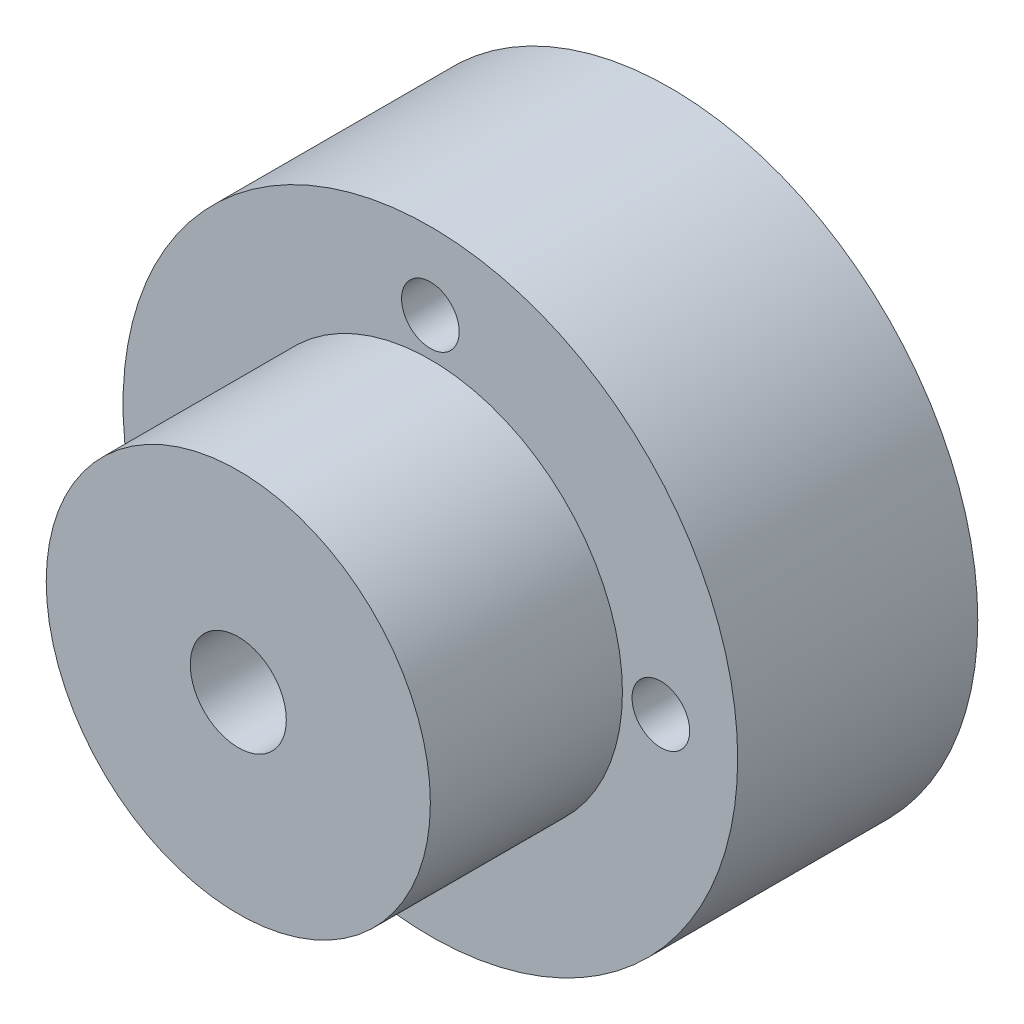
from build123d import *

# Parameters (mm, degrees)
SKETCH_1_R          = 16
EXTRUDE_1_DEPTH     = 12.5
SKETCH_2_R          = 10
EXTRUDE_2_DEPTH     = 10
SKETCH_3_R          = 2.5
CUT_EXTRUDE_1_DEPTH = 32.910029771
SKETCH_4_R          = 1.5
CUT_EXTRUDE_2_DEPTH = 32.910029771


with BuildPart() as part:
    # 草图1 → 凸台-拉伸1 (new body)
    with BuildSketch(Plane.XY):
        Circle(SKETCH_1_R)
    extrude(amount=EXTRUDE_1_DEPTH)

    # 草图2 → 凸台-拉伸2 (add)
    with BuildSketch(Plane.XY.offset(12.5)):
        Circle(SKETCH_2_R)
    extrude(amount=EXTRUDE_2_DEPTH)

    # 草图3 → 切除-拉伸1 (cut, through all)
    with BuildSketch(Plane.XY.offset(22.5)):
        Circle(SKETCH_3_R)
    extrude(amount=-CUT_EXTRUDE_1_DEPTH, mode=Mode.SUBTRACT)

    # 草图4 → 切除-拉伸2 (cut, through all)
    with BuildSketch(Plane(origin=(0, 0, 0), x_dir=(-1, 0, 0), z_dir=(0, 0, -1))):
        with Locations((0, 12)):
            Circle(SKETCH_4_R)
        with Locations((12, 0)):
            Circle(SKETCH_4_R)
        with Locations((0, -12)):
            Circle(SKETCH_4_R)
        with Locations((-12, 0)):
            Circle(SKETCH_4_R)
    extrude(amount=-CUT_EXTRUDE_2_DEPTH, mode=Mode.SUBTRACT)


solid = part.part
